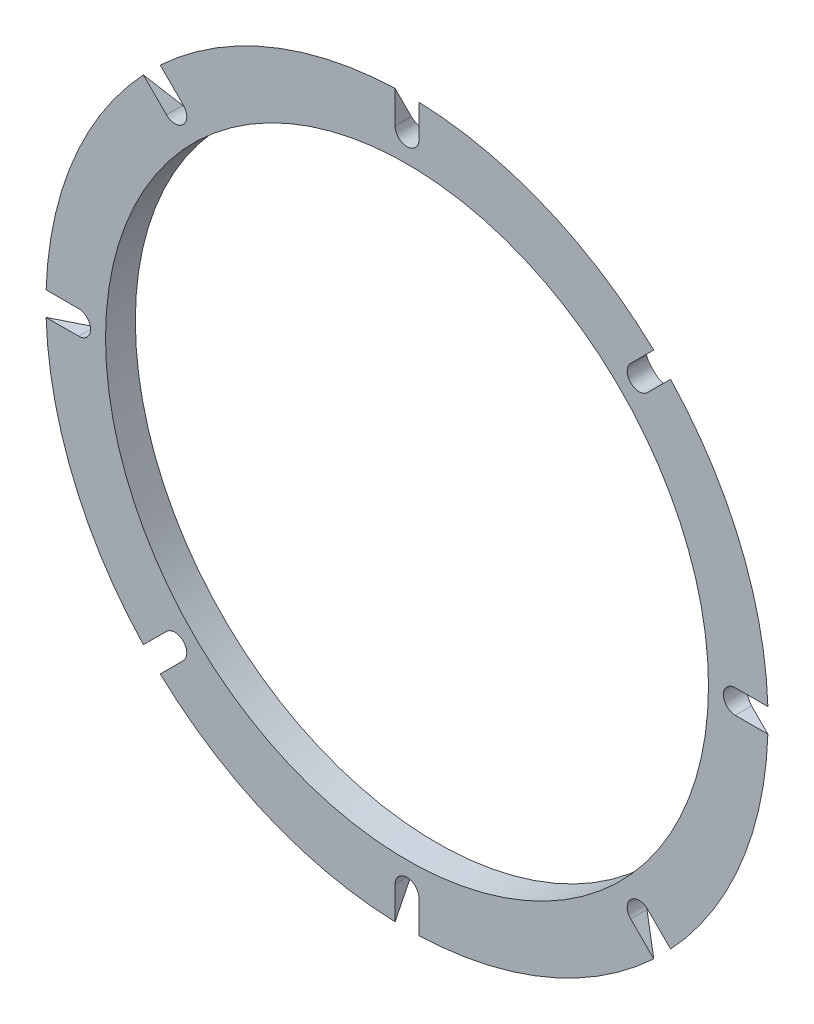
from build123d import *

# Parameters (mm, degrees)
CUT_EXTRUDE1_DEPTH = 10
CIRPATTERN1_COUNT  = 8


with BuildPart() as part:
    # Sketch2 → Revolve1 (revolve)
    with BuildSketch(Plane(origin=(0, 0, 0), x_dir=(0, 0, -1), z_dir=(1, 0, 0)), mode=Mode.PRIVATE) as revolve1_sk:
        Polygon((0, 121.15), (0, 101.15), (10, 101.15), align=None)
    revolve(revolve1_sk.sketch.rotate(Axis((0, 0, 25.61681186), (0, 0, -1)), 90), axis=Axis((0, 0, 25.61681186), (0, 0, -1)))

    # Sketch3 → Cut-Extrude1 (cut)
    with BuildSketch(Plane.XY):
        with BuildLine():
            Line((-4, 110.15), (-4, 131.372704066))
            Line((-4, 131.372704066), (4, 131.372704066))
            Line((4, 131.372704066), (4, 110.15))
            ThreePointArc((4, 110.15), (0, 106.15), (-4, 110.15))
        make_face()
    cut_extrude1 = extrude(amount=-CUT_EXTRUDE1_DEPTH, mode=Mode.SUBTRACT)

    # CirPattern1: Cut-Extrude1 ×8 about axis
    cirpattern1_axis = Axis((0, 0, 0), (0, 0, 1))
    for i in range(1, CIRPATTERN1_COUNT):
        add(cut_extrude1.rotate(cirpattern1_axis, i * 360 / CIRPATTERN1_COUNT), mode=Mode.SUBTRACT)


solid = part.part
